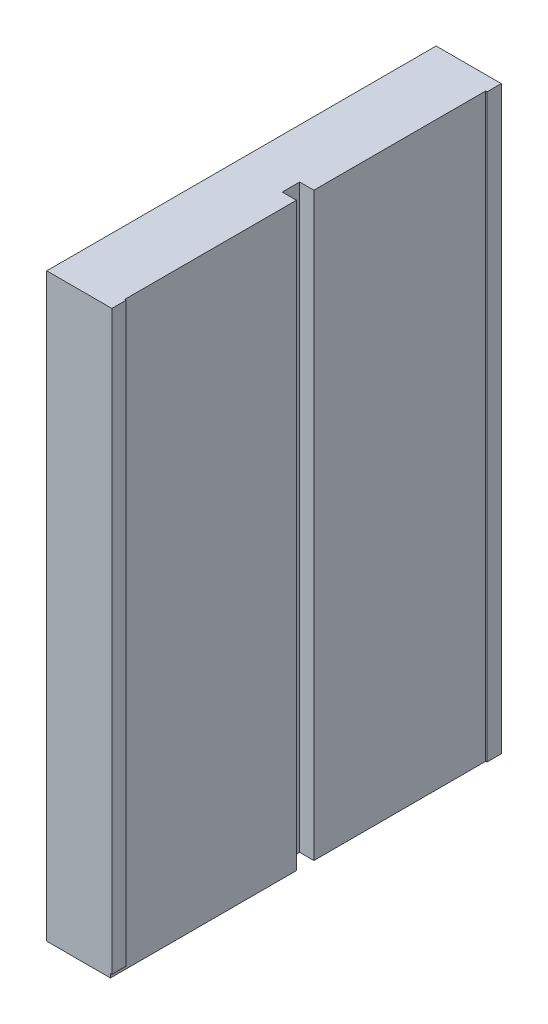
from build123d import *

# Parameters (mm, degrees)
SKETCH1_W           = 9
SKETCH1_H           = 55
BOSS_EXTRUDE1_DEPTH = 82
SKETCH2_W           = 1.230757027
SKETCH2_H           = 82
CUT_EXTRUDE1_DEPTH  = 2
SKETCH3_W           = 2
SKETCH3_H           = 81.454636245
SKETCH3_H_2         = 81.981396298
BOSS_EXTRUDE2_DEPTH = 0.2


with BuildPart() as part:
    # Sketch1 → Boss-Extrude1 (new body)
    with BuildSketch(Plane(origin=(0, 0, 0), x_dir=(1, 0, 0), z_dir=(0, 1, 0))):
        Rectangle(SKETCH1_W, SKETCH1_H)
    extrude(amount=BOSS_EXTRUDE1_DEPTH)

    # Sketch2 → Cut-Extrude1 (cut)
    with BuildSketch(Plane(origin=(4.5, 0, 0), x_dir=(0, 0, -1), z_dir=(1, 0, 0))):
        with Locations((-0.615378514, 41)):
            Rectangle(SKETCH2_W, SKETCH2_H)
        with Locations((0.615378514, 41)):
            Rectangle(SKETCH2_W, SKETCH2_H)
    extrude(amount=-CUT_EXTRUDE1_DEPTH, mode=Mode.SUBTRACT)

    # Sketch3 → Boss-Extrude2 (add)
    with BuildSketch(Plane(origin=(4.5, 0, 0), x_dir=(0, 0, -1), z_dir=(1, 0, 0))):
        with Locations((-26.5, 41.272681877)):
            Rectangle(SKETCH3_W, SKETCH3_H)
        with Locations((26.5, 41.009301851)):
            Rectangle(SKETCH3_W, SKETCH3_H_2)
    extrude(amount=BOSS_EXTRUDE2_DEPTH)


solid = part.part
